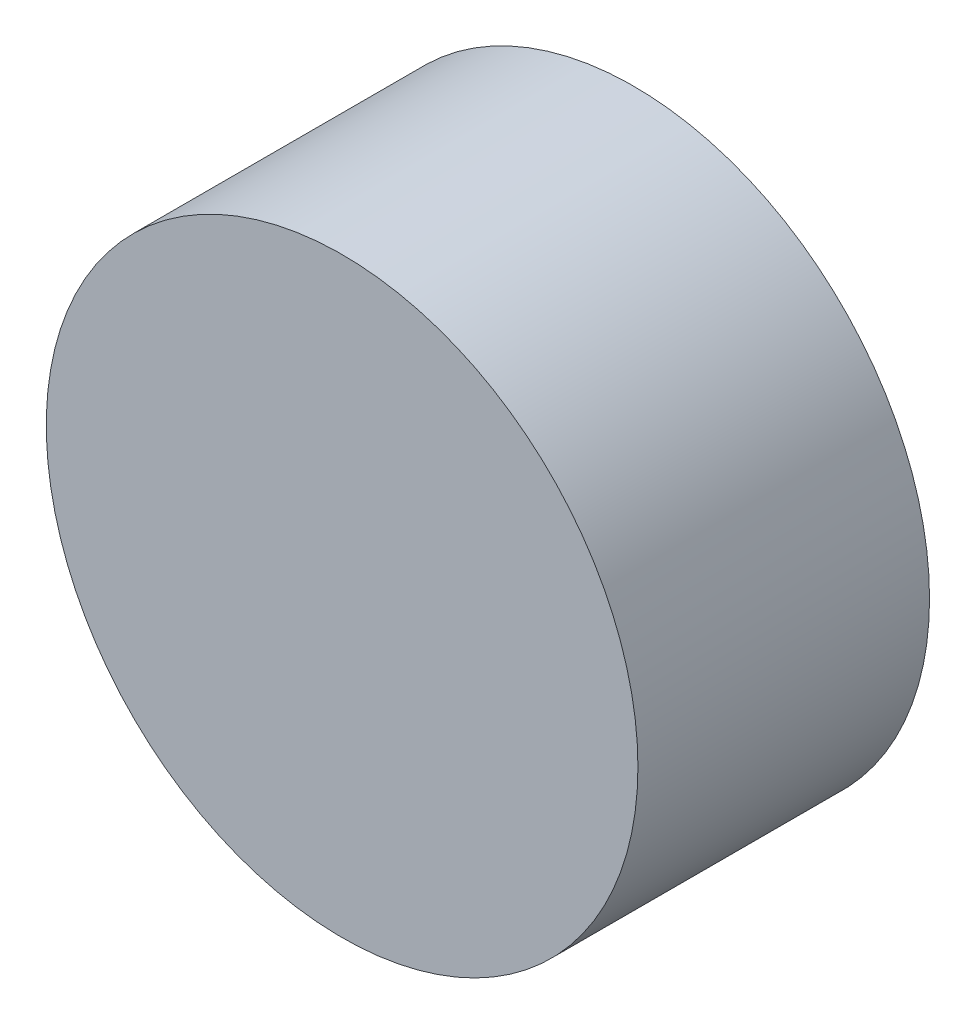
from build123d import *

# Parameters (mm, degrees)
ESQUISSE1_R        = 1.4
BOSS_EXTRU_1_DEPTH = 1.38


with BuildPart() as part:
    # Esquisse1 → Boss.-Extru.1 (new body)
    with BuildSketch(Plane.XY):
        Circle(ESQUISSE1_R)
    extrude(amount=BOSS_EXTRU_1_DEPTH)


solid = part.part
